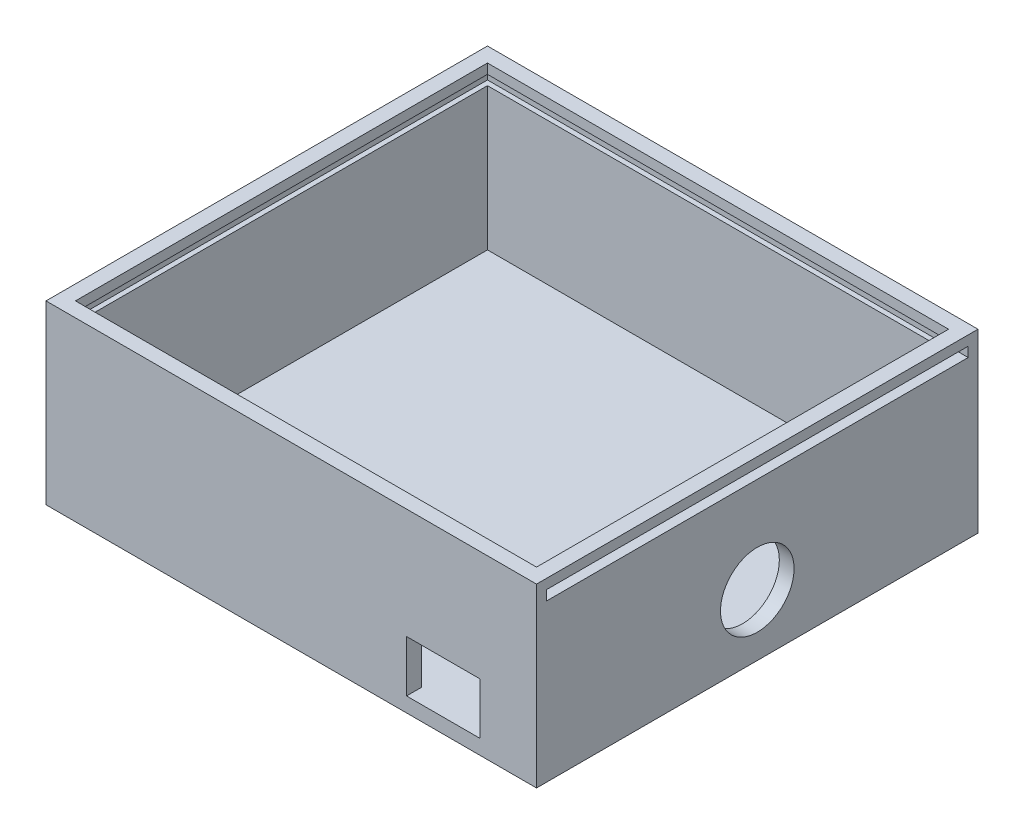
from build123d import *

# Parameters (mm, degrees)
SKETCH1_W           = 100
SKETCH1_H           = 36
BOSS_EXTRUDE1_DEPTH = 90
SHELL2_T            = -3
SKETCH3_W           = 15
SKETCH3_H           = 10.5
CUT_EXTRUDE3_DEPTH  = 10
SKETCH5_W           = 86
SKETCH5_H           = 2
CUT_EXTRUDE4_DEPTH  = 98
SKETCH6_R           = 7.5
CUT_EXTRUDE5_DEPTH  = 10


with BuildPart() as part:
    # Sketch1 → Boss-Extrude1 (new body)
    with BuildSketch(Plane.XY):
        with Locations((50, -18)):
            Rectangle(SKETCH1_W, SKETCH1_H)
    extrude(amount=BOSS_EXTRUDE1_DEPTH)

    # Shell2
    shell2_openings = [part.faces().sort_by_distance(p)[0] for p in [
        (50, 0, 45),
    ]]
    offset(amount=SHELL2_T, openings=shell2_openings, kind=Kind.INTERSECTION)

    # Sketch3 → Cut-Extrude3 (cut)
    with BuildSketch(Plane.XY.offset(90)):
        with Locations((81, -27.75)):
            Rectangle(SKETCH3_W, SKETCH3_H)
    extrude(amount=-CUT_EXTRUDE3_DEPTH, mode=Mode.SUBTRACT)

    # Sketch5 → Cut-Extrude4 (cut)
    with BuildSketch(Plane(origin=(100, 0, 0), x_dir=(0, 0, -1), z_dir=(1, 0, 0))):
        with Locations((-45, -3)):
            Rectangle(SKETCH5_W, SKETCH5_H)
    extrude(amount=-CUT_EXTRUDE4_DEPTH, mode=Mode.SUBTRACT)

    # Sketch6 → Cut-Extrude5 (cut)
    with BuildSketch(Plane(origin=(100, 0, 0), x_dir=(0, 0, -1), z_dir=(1, 0, 0))):
        with Locations((-45, -23.5)):
            Circle(SKETCH6_R)
    extrude(amount=-CUT_EXTRUDE5_DEPTH, mode=Mode.SUBTRACT)


solid = part.part
